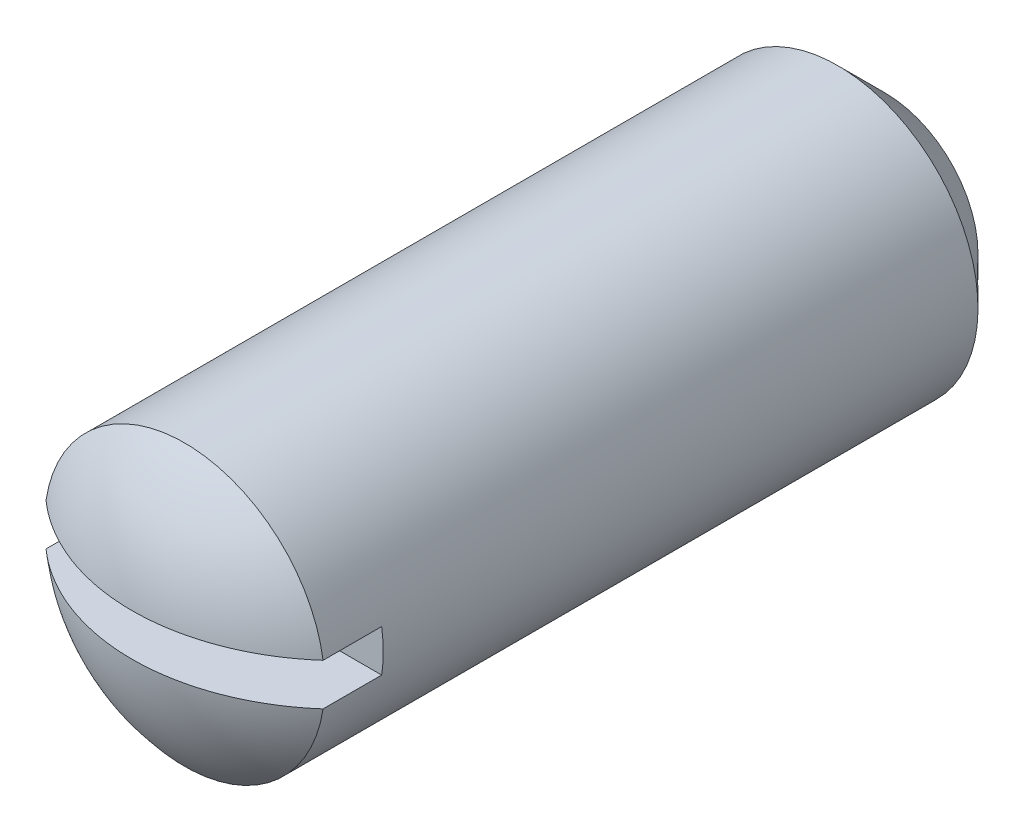
from build123d import *

# Parameters (mm, degrees)
SKETCH_1_W          = 20
SKETCH_1_H          = 4
CHAMFER_1_SIZE      = 1.35
SKETCH_2_W          = 3.34427191
SKETCH_2_H          = 1.2
CUT_EXTRUDE_1_DEPTH = 5


with BuildPart() as part:
    # Эскиз1 → Повернуть1 (revolve)
    with BuildSketch(Plane(origin=(0, 0, 0), x_dir=(0, 0, -1), z_dir=(1, 0, 0))):
        with BuildLine():
            Line((-10, 0), (-10, 4))
            ThreePointArc((-10, 4), (-11.132898199, 2.140932539), (-11.527864045, 0))
            Line((-11.527864045, 0), (-10, 0))
        make_face()
        with Locations((0, 2)):
            Rectangle(SKETCH_1_W, SKETCH_1_H)
    revolve(axis=Axis((0, 0, -10), (0, 0, 1)))

    # Фаска1
    chamfer_1_edges = [part.edges().sort_by_distance(p)[0] for p in [
        (0, -4, -10),
    ]]
    chamfer(chamfer_1_edges, length=CHAMFER_1_SIZE)

    # Эскиз2 → Вырез-Вытянуть1 (cut, symmetric)
    with BuildSketch(Plane(origin=(0, 0, 0), x_dir=(0, 0, -1), z_dir=(1, 0, 0))):
        with Locations((-10, 0)):
            Rectangle(SKETCH_2_W, SKETCH_2_H)
    extrude(amount=CUT_EXTRUDE_1_DEPTH, both=True, mode=Mode.SUBTRACT)


solid = part.part
